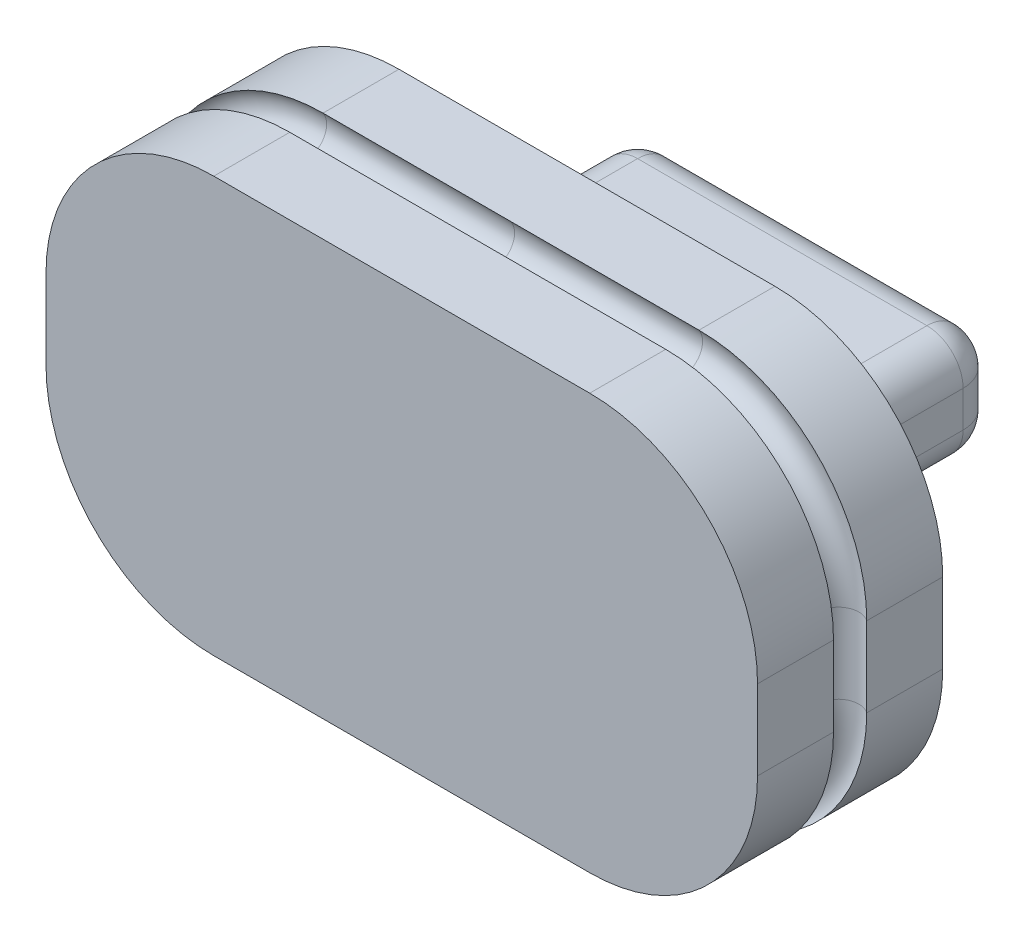
from build123d import *

# Parameters (mm, degrees)
BOSS_EXTRUDE1_DEPTH = 8.128
BOSS_EXTRUDE3_DEPTH = 10.16
FILLET1_R           = 1.5875
SKETCH12_R          = 0.889


with BuildPart() as part:
    # Sketch1 → Boss-Extrude1 (new body)
    with BuildSketch(Plane.XY):
        with BuildLine():
            Line((-243.375083311, 1536.494901352), (-243.375083311, 1532.994901352))
            ThreePointArc((-243.375083311, 1532.994901352), (-241.217924755, 1527.787059909), (-236.010083311, 1525.629901352))
            Line((-236.010083311, 1525.629901352), (-219.510083311, 1525.629901352))
            ThreePointArc((-219.510083311, 1525.629901352), (-214.302241868, 1527.787059909), (-212.145083311, 1532.994901352))
            Line((-212.145083311, 1532.994901352), (-212.145083311, 1536.494901352))
            ThreePointArc((-212.145083311, 1536.494901352), (-214.302241868, 1541.702742796), (-219.510083311, 1543.859901352))
            Line((-219.510083311, 1543.859901352), (-236.010083311, 1543.859901352))
            ThreePointArc((-236.010083311, 1543.859901352), (-241.217924755, 1541.702742796), (-243.375083311, 1536.494901352))
        make_face()
    extrude(amount=BOSS_EXTRUDE1_DEPTH)

    # Sketch3 → Boss-Extrude3 (add)
    with BuildSketch(Plane(origin=(0, 0, 0), x_dir=(-1, 0, 0), z_dir=(0, 0, -1))):
        with BuildLine():
            Line((234.110083311, 1532.363651352), (221.410083311, 1532.363651352))
            ThreePointArc((221.410083311, 1532.363651352), (220.287551296, 1532.828619337), (219.822583311, 1533.951151352))
            Line((219.822583311, 1533.951151352), (219.822583311, 1535.538651352))
            ThreePointArc((219.822583311, 1535.538651352), (220.287551296, 1536.661183368), (221.410083311, 1537.126151352))
            Line((221.410083311, 1537.126151352), (234.110083311, 1537.126151352))
            ThreePointArc((234.110083311, 1537.126151352), (235.232615326, 1536.661183368), (235.697583311, 1535.538651352))
            Line((235.697583311, 1535.538651352), (235.697583311, 1533.951151352))
            ThreePointArc((235.697583311, 1533.951151352), (235.232615326, 1532.828619337), (234.110083311, 1532.363651352))
        make_face()
    extrude(amount=BOSS_EXTRUDE3_DEPTH)

    # Fillet1
    fillet1_edges = [part.edges().sort_by_distance(p)[0] for p in [
        (-227.760083311, 1537.126151352, -10.16),
        (-235.232615326, 1536.661183368, -10.16),
        (-235.697583311, 1534.744901352, -10.16),
        (-235.232615326, 1532.828619337, -10.16),
        (-227.760083311, 1532.363651352, -10.16),
        (-220.287551296, 1532.828619337, -10.16),
        (-219.822583311, 1534.744901352, -10.16),
        (-220.287551296, 1536.661183368, -10.16),
    ]]
    fillet(fillet1_edges, radius=FILLET1_R)

    # Cut-Sweep1: sweep along a path in Sketch13
    with BuildLine(Plane.XY.offset(4.064)) as cut_sweep1_path:
        Line((-243.375083311, 1536.494901352), (-243.375083311, 1532.994901352))
        ThreePointArc((-243.375083311, 1532.994901352), (-241.217924755, 1527.787059909), (-236.010083311, 1525.629901352))
        Line((-236.010083311, 1525.629901352), (-219.510083311, 1525.629901352))
        ThreePointArc((-219.510083311, 1525.629901352), (-214.302241868, 1527.787059909), (-212.145083311, 1532.994901352))
        Line((-212.145083311, 1532.994901352), (-212.145083311, 1536.494901352))
        ThreePointArc((-212.145083311, 1536.494901352), (-214.302241868, 1541.702742796), (-219.510083311, 1543.859901352))
        Line((-219.510083311, 1543.859901352), (-236.010083311, 1543.859901352))
        ThreePointArc((-236.010083311, 1543.859901352), (-241.217924755, 1541.702742796), (-243.375083311, 1536.494901352))
    # Sketch12 → Cut-Sweep1 (sweep, cut)
    with BuildSketch(Plane.ZY.offset(227.760083311)):
        with Locations((4.064, 1543.351901352)):
            Circle(SKETCH12_R)
    sweep(path=cut_sweep1_path.line, mode=Mode.SUBTRACT)


solid = part.part
